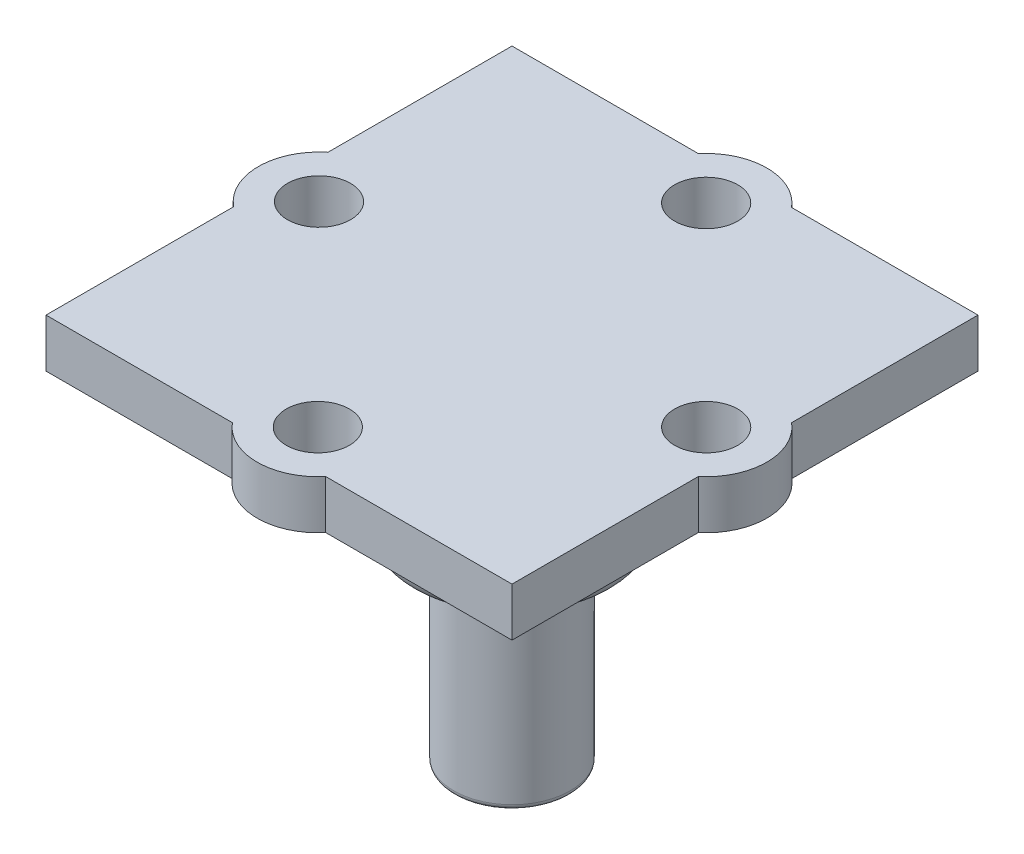
from build123d import *

# Parameters (mm, degrees)
SKETCH1_R           = 3.25
BOSS_EXTRUDE1_DEPTH = 5
SKETCH2_W           = 32.64938716
SKETCH2_H           = 32.90693226
BOSS_EXTRUDE2_DEPTH = 5
SKETCH3_R           = 10.567193536
BOSS_EXTRUDE3_DEPTH = 15
SKETCH4_R           = 6
BOSS_EXTRUDE4_DEPTH = 20
FILLET1_R           = 2
FILLET2_R           = 0.56


with BuildPart() as part:
    # Sketch1 → Boss-Extrude1 (new body)
    with BuildSketch(Plane(origin=(0, 0, 0), x_dir=(1, 0, 0), z_dir=(0, 1, 0))):
        with BuildLine():
            Line((-24, -4.668943148), (-24, -24))
            Line((-24, -24), (-4.802343178, -24))
            ThreePointArc((-4.802343178, -24), (0, -26.25), (4.802343178, -24))
            Line((4.802343178, -24), (24, -24))
            Line((24, -24), (24, -4.802343178))
            ThreePointArc((24, -4.802343178), (26.25, 0), (24, 4.802343178))
            Line((24, 4.802343178), (24, 24))
            Line((24, 24), (4.802343178, 24))
            ThreePointArc((4.802343178, 24), (0, 26.25), (-4.802343178, 24))
            Line((-4.802343178, 24), (-24, 24))
            Line((-24, 24), (-24, 5.04363247))
            ThreePointArc((-24, 5.04363247), (-26.315667945, 0.187344661), (-24, -4.668943148))
        make_face()
        with Locations(Location((-20.065667945, 0.187344661, 0), (0, 0, 270))):
            Circle(SKETCH1_R, mode=Mode.SUBTRACT)
        with Locations(Location((0, 20, 0), (0, 0, 270))):
            Circle(SKETCH1_R, mode=Mode.SUBTRACT)
        with Locations(Location((20, 0, 0), (0, 0, 270))):
            Circle(SKETCH1_R, mode=Mode.SUBTRACT)
        with Locations(Location((0, -20, 0), (0, 0, 270))):
            Circle(SKETCH1_R, mode=Mode.SUBTRACT)
        with BuildLine():
            Line((-16, 16), (-4.802343178, 16))
            ThreePointArc((-4.802343178, 16), (0, 13.75), (4.802343178, 16))
            Line((4.802343178, 16), (16, 16))
            Line((16, 16), (16, 4.802343178))
            ThreePointArc((16, 4.802343178), (13.75, 0), (16, -4.802343178))
            Line((16, -4.802343178), (16, -16))
            Line((16, -16), (4.802343178, -16))
            ThreePointArc((4.802343178, -16), (0, -13.75), (-4.802343178, -16))
            Line((-4.802343178, -16), (-16, -16))
            Line((-16, -16), (-16, -4.559532645))
            ThreePointArc((-16, -4.559532645), (-13.815667945, 0.187344661), (-16, 4.934221967))
            Line((-16, 4.934221967), (-16, 16))
        make_face(mode=Mode.SUBTRACT)
    extrude(amount=BOSS_EXTRUDE1_DEPTH)

    # Sketch2 → Boss-Extrude2 (add)
    with BuildSketch(Plane.XZ):
        Rectangle(SKETCH2_W, SKETCH2_H)
    extrude(amount=-BOSS_EXTRUDE2_DEPTH)

    # Sketch3 → Boss-Extrude3 (add)
    with BuildSketch(Plane(origin=(0, 0, 0), x_dir=(-1, 0, 0), z_dir=(0, -1, 0))):
        with Locations(Location((0, 0, 0), (0, 0, 270))):
            Circle(SKETCH3_R)
    extrude(amount=BOSS_EXTRUDE3_DEPTH)

    # Sketch4 → Boss-Extrude4 (add)
    with BuildSketch(Plane(origin=(0, -15, 0), x_dir=(-1, 0, 0), z_dir=(0, -1, 0))):
        with Locations(Location((0, 0, 0), (0, 0, 90))):
            Circle(SKETCH4_R)
    extrude(amount=BOSS_EXTRUDE4_DEPTH)

    # Fillet1
    fillet1_edges = [part.edges().sort_by_distance(p)[0] for p in [
        (0, 0, -10.567193536),
        (0, -15, -10.567193536),
        (0, -15, 6),
    ]]
    fillet(fillet1_edges, radius=FILLET1_R)

    # Fillet2
    fillet2_edges = [part.edges().sort_by_distance(p)[0] for p in [
        (0, -35, 6),
    ]]
    fillet(fillet2_edges, radius=FILLET2_R)


solid = part.part
